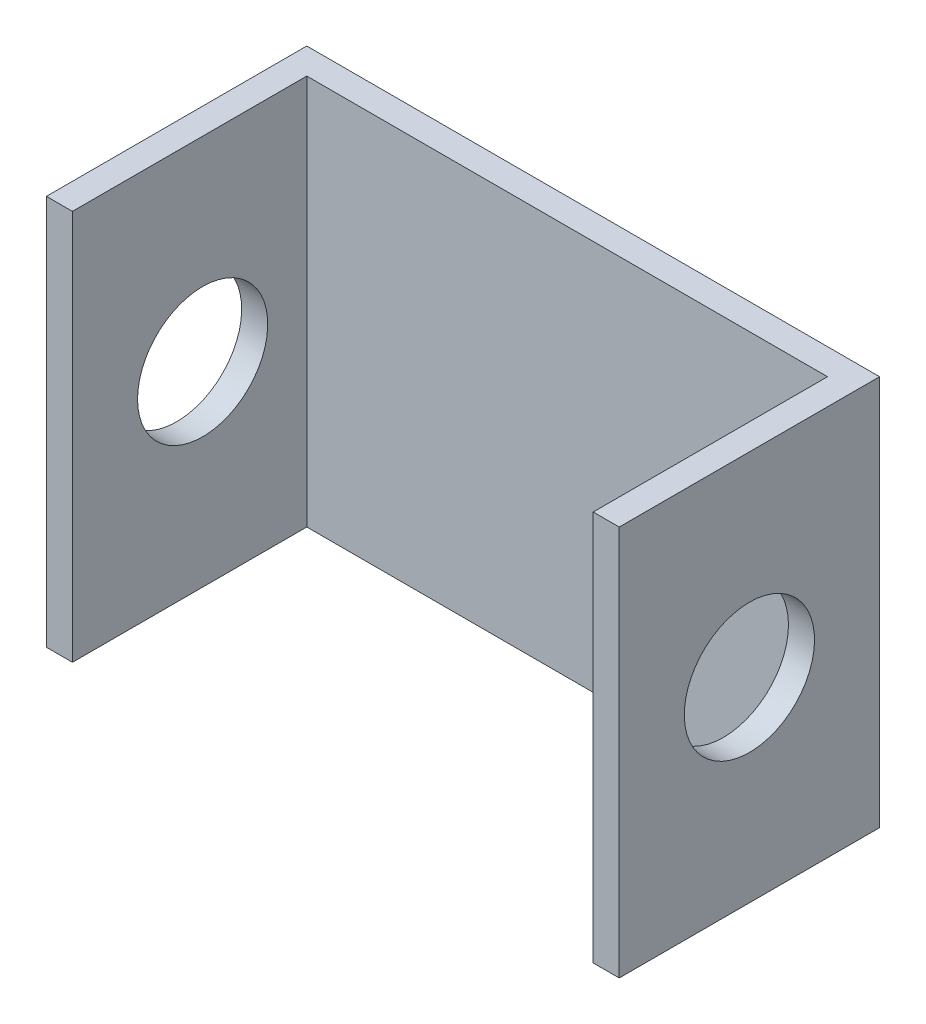
from build123d import *

# Parameters (mm, degrees)
SKETCH1_W           = 40
SKETCH1_H           = 30
BOSS_EXTRUDE1_DEPTH = 2
SKETCH2_W           = 20
SKETCH2_H           = 30
BOSS_EXTRUDE2_DEPTH = 2
SKETCH3_W           = 20
SKETCH3_H           = 30
BOSS_EXTRUDE3_DEPTH = 2
SKETCH5_R           = 5
CUT_EXTRUDE2_DEPTH  = 55.595167513


with BuildPart() as part:
    # Sketch1 → Boss-Extrude1 (new body)
    with BuildSketch(Plane.XY):
        with Locations((-21.168831169, 10.38961039)):
            Rectangle(SKETCH1_W, SKETCH1_H)
    extrude(amount=BOSS_EXTRUDE1_DEPTH)

    # Sketch2 → Boss-Extrude2 (add)
    with BuildSketch(Plane.ZY.offset(41.168831169)):
        with Locations((10, 10.38961039)):
            Rectangle(SKETCH2_W, SKETCH2_H)
    extrude(amount=BOSS_EXTRUDE2_DEPTH)

    # Sketch3 → Boss-Extrude3 (add)
    with BuildSketch(Plane(origin=(-1.168831169, 0, 0), x_dir=(0, 0, -1), z_dir=(1, 0, 0))):
        with Locations((-10, 10.38961039)):
            Rectangle(SKETCH3_W, SKETCH3_H)
    extrude(amount=BOSS_EXTRUDE3_DEPTH)

    # Sketch5 → Cut-Extrude2 (cut, through all)
    with BuildSketch(Plane(origin=(0.831168831, 0, 0), x_dir=(0, 0, -1), z_dir=(1, 0, 0))):
        with Locations(Location((-10, 10.38961039, 0), (0, 0, 90))):
            Circle(SKETCH5_R)
    extrude(amount=-CUT_EXTRUDE2_DEPTH, mode=Mode.SUBTRACT)


solid = part.part
